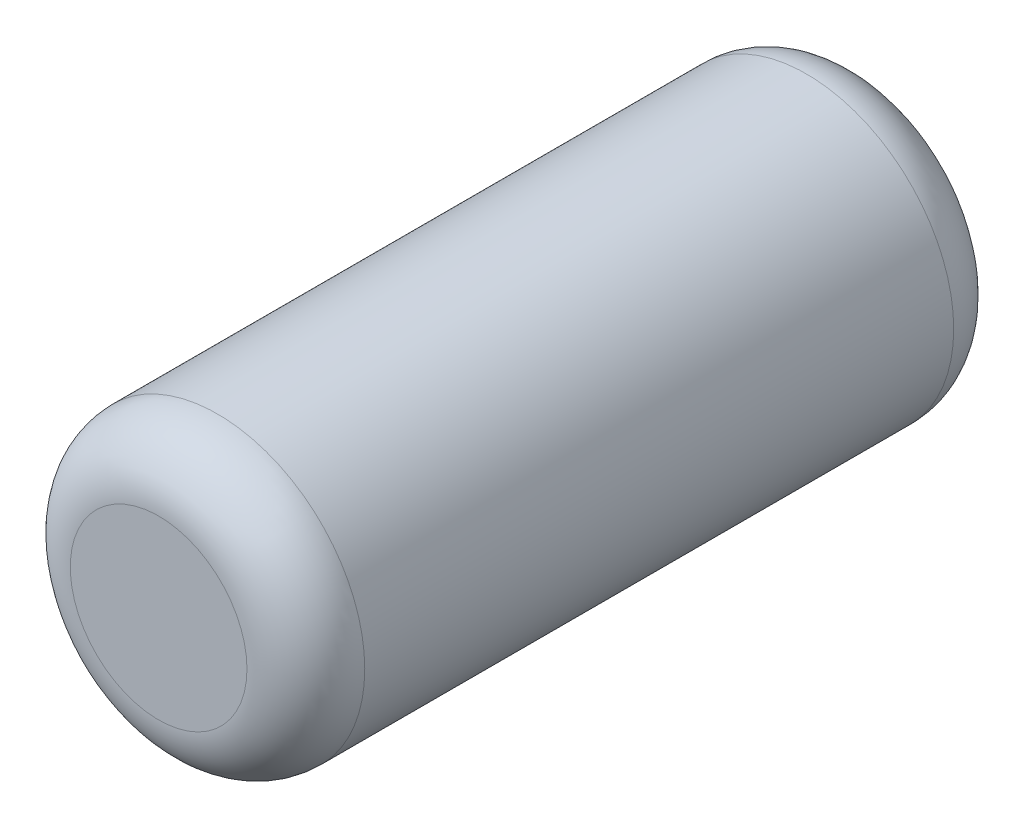
from build123d import *

# Parameters (mm, degrees)
SKETCH1_R           = 2.5
BOSS_EXTRUDE1_DEPTH = 12
FILLET1_R           = 1
SCALE1_SCALE        = 0.7


with BuildPart() as part:
    # Sketch1 → Boss-Extrude1 (new body)
    with BuildSketch(Plane(origin=(0, 0, 0), x_dir=(0, 1, 0), z_dir=(0, 0, 1))):
        with Locations(Location((0, 0, 0), (0, 0, 270))):
            Circle(SKETCH1_R)
    extrude(amount=-BOSS_EXTRUDE1_DEPTH)

    # Fillet1
    fillet1_edges = [part.edges().sort_by_distance(p)[0] for p in [
        (-2.5, 0, 0),
        (-2.5, 0, -12),
    ]]
    fillet(fillet1_edges, radius=FILLET1_R)


with BuildPart() as part_1:
    # Scale1: scaled about (0, 0, -6)
    add(part.part.scale(SCALE1_SCALE).moved(Location((0, 0, -1.8))))


solid = part_1.part
